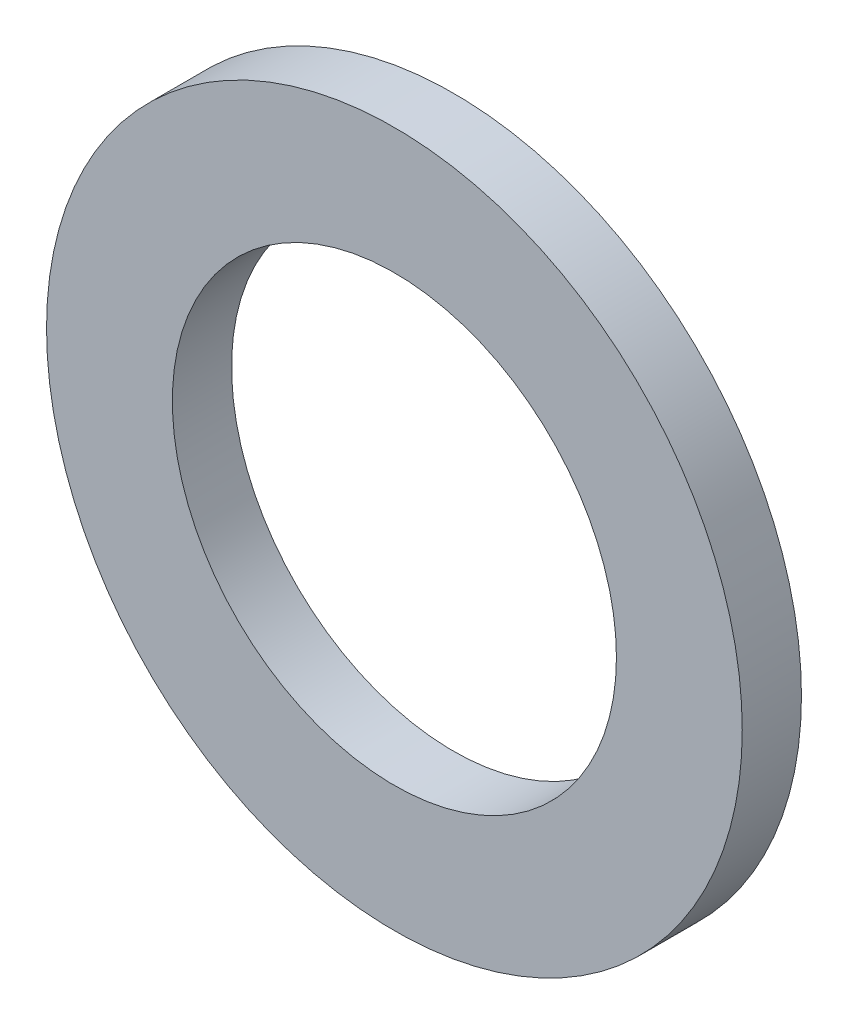
from build123d import *

# Parameters (mm, degrees)
SKETCH_1_R      = 23.5
SKETCH_1_R_2    = 15
EXTRUDE_1_DEPTH = 4


with BuildPart() as part:
    # 草图1 → 凸台-拉伸1 (new body)
    with BuildSketch(Plane.XY):
        Circle(SKETCH_1_R)
        Circle(SKETCH_1_R_2, mode=Mode.SUBTRACT)
    extrude(amount=EXTRUDE_1_DEPTH)


solid = part.part
